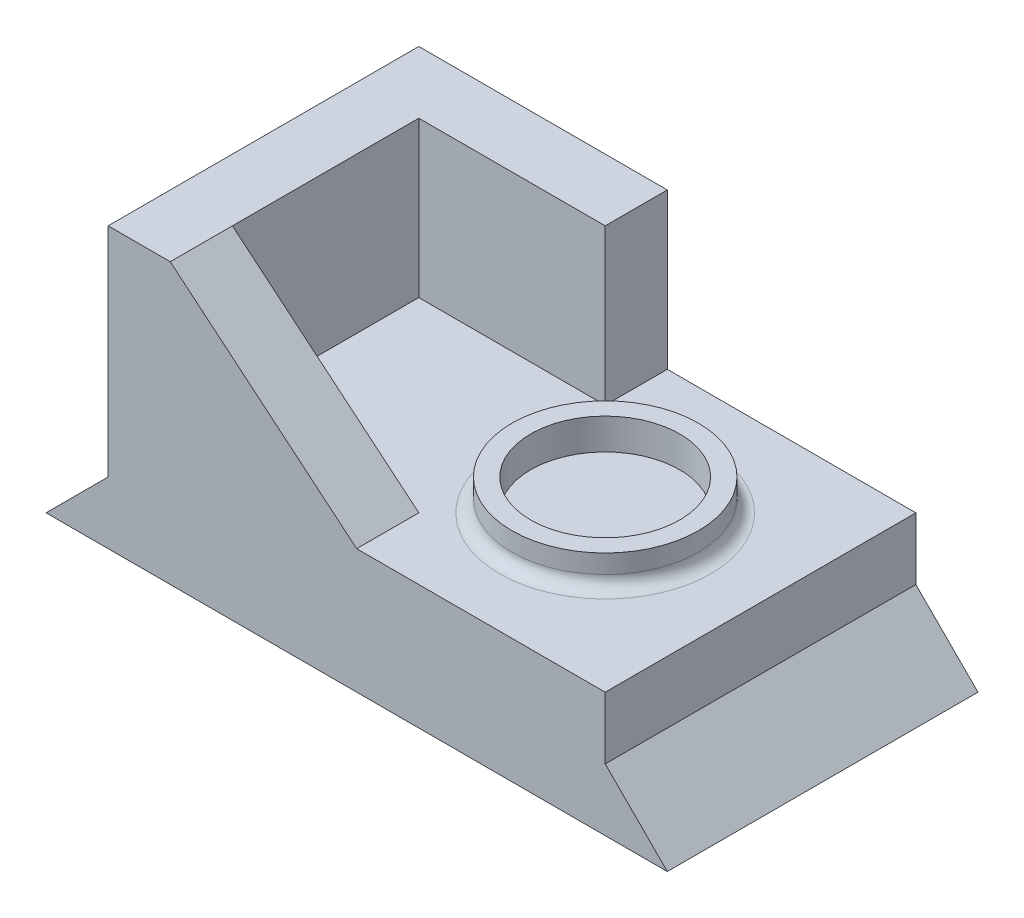
from build123d import *

# Parameters (mm, degrees)
BOSS_EXTRU_1_DEPTH      = 50
ENL_V_MAT_EXTRU_1_DEPTH = 40
ESQUISSE4_W             = 30
ESQUISSE4_H             = 25
BOSS_EXTRU_3_DEPTH      = 10
ESQUISSE5_R             = 15
ESQUISSE5_R_2           = 12
BOSS_EXTRU_4_DEPTH      = 5
CONG_2_R                = 2


with BuildPart() as part:
    # Esquisse1 → Boss.-Extru.1 (new body)
    with BuildSketch(Plane.XY):
        Polygon((0, 0), (10, 10), (10, 45), (20, 45), (50, 20), (90, 20), (90, 10), (100, 0), align=None)
    extrude(amount=-BOSS_EXTRU_1_DEPTH)

    # Esquisse2 → Enlèv. mat.-Extru.1 (cut)
    with BuildSketch(Plane(origin=(0, 0, -50), x_dir=(-1, 0, 0), z_dir=(0, 0, -1))):
        Polygon((-20, 45), (-20, 20), (-50, 20), align=None)
    extrude(amount=-ENL_V_MAT_EXTRU_1_DEPTH, mode=Mode.SUBTRACT)

    # Esquisse4 → Boss.-Extru.3 (add)
    with BuildSketch(Plane(origin=(0, 0, -50), x_dir=(-1, 0, 0), z_dir=(0, 0, -1))):
        with Locations((-35, 32.5)):
            Rectangle(ESQUISSE4_W, ESQUISSE4_H)
    extrude(amount=-BOSS_EXTRU_3_DEPTH)

    # Esquisse5 → Boss.-Extru.4 (add)
    with BuildSketch(Plane(origin=(0, 20, 0), x_dir=(1, 0, 0), z_dir=(0, 1, 0))):
        with Locations(Location((65, 25, 0), (0, 0, 270))):
            Circle(ESQUISSE5_R)
        with Locations(Location((65, 25, 0), (0, 0, 270))):
            Circle(ESQUISSE5_R_2, mode=Mode.SUBTRACT)
    extrude(amount=BOSS_EXTRU_4_DEPTH)

    # Congé2
    cong_2_edges = [part.edges().sort_by_distance(p)[0] for p in [
        (65, 20, -40),
    ]]
    fillet(cong_2_edges, radius=CONG_2_R)


solid = part.part
